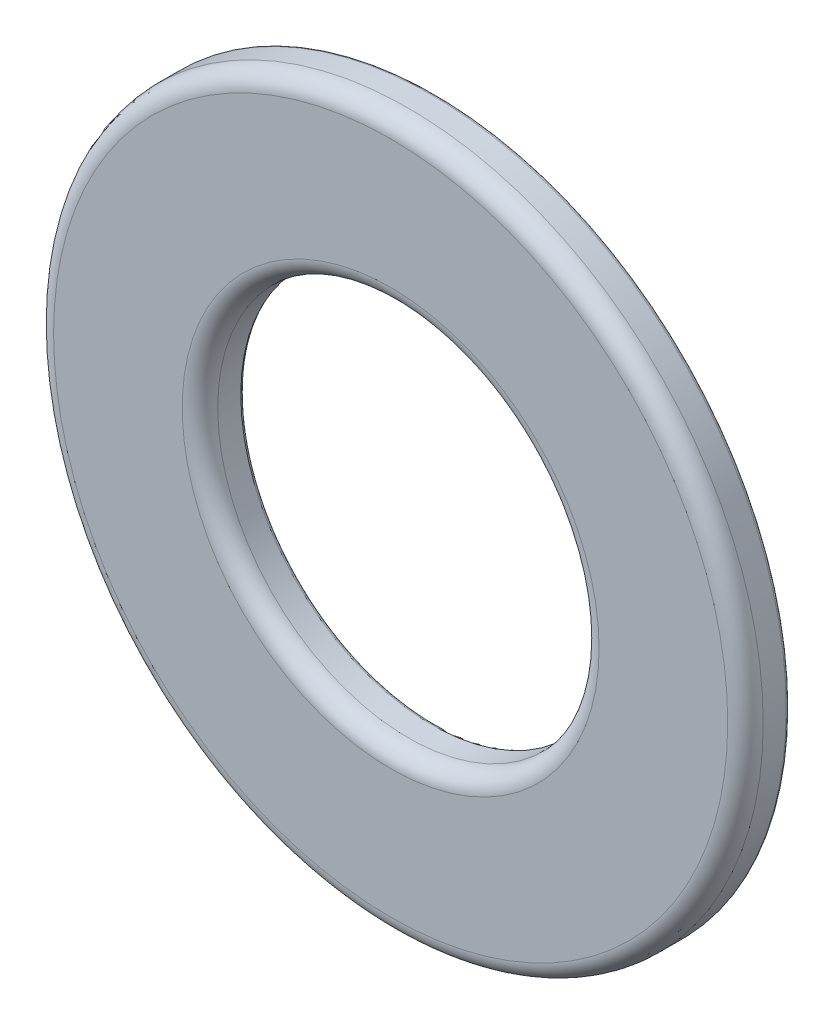
from build123d import *

# Parameters (mm, degrees)
BOSS_EXTRUDE1_DEPTH      = 0.25
BOSS_EXTRUDE1_DEPTH_BACK = 0.25
SKETCH3_R                = 4
SKETCH3_R_2              = 2.15
FILLET1_R                = 0.2
FILLET3_R                = 0.04


with BuildPart() as part:
    # Sketch3 → Boss-Extrude1 (new, two sides: drawn at the far end of the back side and taken through both)
    with BuildSketch(Plane.XY.offset(-BOSS_EXTRUDE1_DEPTH_BACK)):
        Circle(SKETCH3_R)
        Circle(SKETCH3_R_2, mode=Mode.SUBTRACT)
    extrude(amount=BOSS_EXTRUDE1_DEPTH + BOSS_EXTRUDE1_DEPTH_BACK)

    # Fillet1
    fillet1_edges = [part.edges().sort_by_distance(p)[0] for p in [
        (-4, 0, 0.25),
        (-2.15, 0, 0.25),
    ]]
    fillet(fillet1_edges, radius=FILLET1_R)

    # Fillet3
    fillet3_edges = [part.edges().sort_by_distance(p)[0] for p in [
        (-4, 0, -0.25),
        (-2.15, 0, -0.25),
    ]]
    fillet(fillet3_edges, radius=FILLET3_R)


solid = part.part
